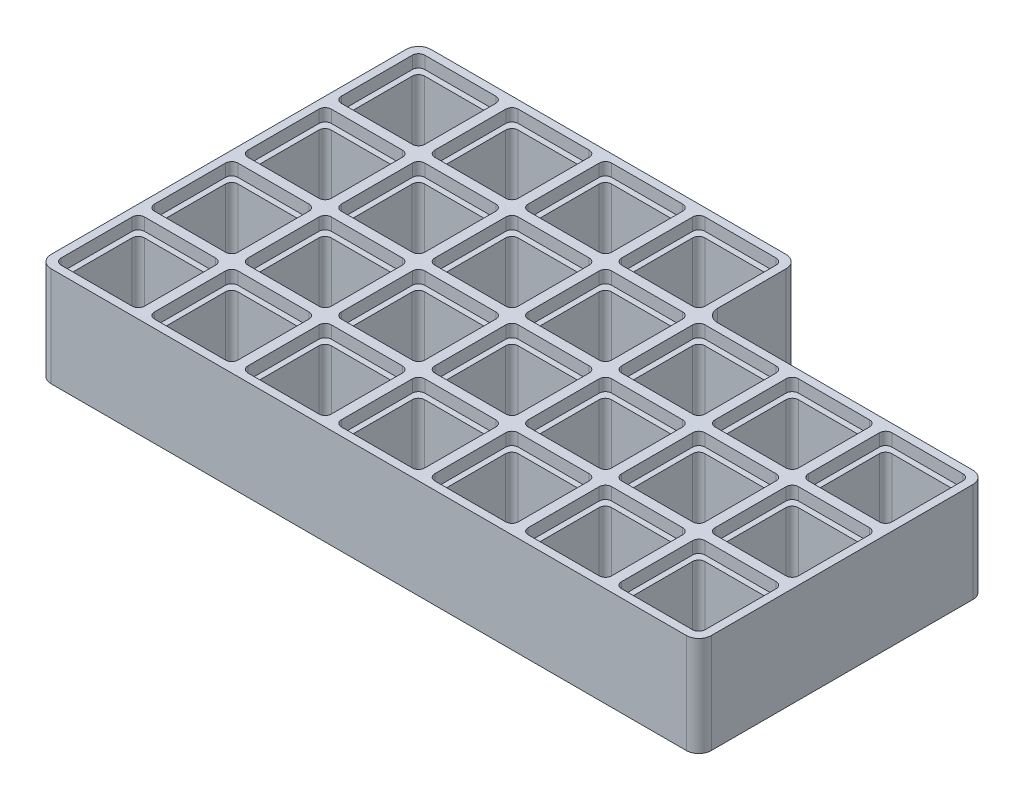
from build123d import *

# Parameters (mm, degrees)
EXTRUDE_1_DEPTH     = 16
CUT_EXTRUDE_2_DEPTH = 18
CUT_EXTRUDE_3_DEPTH = 2
SKETCH_4_R          = 1.5
EXTRUDE_2_DEPTH     = 1.6


with BuildPart() as part:
    # 草图1 → 凸台-拉伸1 (new body)
    with BuildSketch(Plane(origin=(0, 0, 0), x_dir=(1, 0, 0), z_dir=(0, 1, 0))):
        with BuildLine():
            Line((-45, 59), (-45, 48))
            ThreePointArc((-45, 48), (-44.414213562, 46.585786438), (-43, 46))
            Line((-43, 46), (-2, 46))
            ThreePointArc((-2, 46), (-0.585786438, 45.414213562), (0, 44))
            Line((0, 44), (0, 2))
            ThreePointArc((0, 2), (-0.585786438, 0.585786438), (-2, 0))
            Line((-2, 0), (-104, 0))
            ThreePointArc((-104, 0), (-105.414213562, 0.585786438), (-106, 2))
            Line((-106, 2), (-106, 59))
            ThreePointArc((-106, 59), (-105.414213562, 60.414213562), (-104, 61))
            Line((-104, 61), (-47, 61))
            ThreePointArc((-47, 61), (-45.585786438, 60.414213562), (-45, 59))
        make_face()
    extrude(amount=EXTRUDE_1_DEPTH)

    # 草图3 → 切除-拉伸2 (cut)
    with BuildSketch(Plane.XZ):
        with BuildLine():
            Line((-102.8, -2.22), (-93.2, -2.22))
            ThreePointArc((-93.2, -2.22), (-92.492893219, -2.512893219), (-92.2, -3.22))
            Line((-92.2, -3.22), (-92.2, -12.78))
            ThreePointArc((-92.2, -12.78), (-92.492893219, -13.487106781), (-93.2, -13.78))
            Line((-93.2, -13.78), (-102.8, -13.78))
            ThreePointArc((-102.8, -13.78), (-103.507106781, -13.487106781), (-103.8, -12.78))
            Line((-103.8, -12.78), (-103.8, -3.22))
            ThreePointArc((-103.8, -3.22), (-103.507106781, -2.512893219), (-102.8, -2.22))
        make_face()
        with BuildLine():
            Line((-103.8, -18.22), (-103.8, -27.78))
            ThreePointArc((-103.8, -27.78), (-103.507106781, -28.487106781), (-102.8, -28.78))
            Line((-102.8, -28.78), (-93.2, -28.78))
            ThreePointArc((-93.2, -28.78), (-92.492893219, -28.487106781), (-92.2, -27.78))
            Line((-92.2, -27.78), (-92.2, -18.22))
            ThreePointArc((-92.2, -18.22), (-92.492893219, -17.512893219), (-93.2, -17.22))
            Line((-93.2, -17.22), (-102.8, -17.22))
            ThreePointArc((-102.8, -17.22), (-103.507106781, -17.512893219), (-103.8, -18.22))
        make_face()
        with BuildLine():
            Line((-103.8, -33.22), (-103.8, -42.78))
            ThreePointArc((-103.8, -42.78), (-103.507106781, -43.487106781), (-102.8, -43.78))
            Line((-102.8, -43.78), (-93.2, -43.78))
            ThreePointArc((-93.2, -43.78), (-92.492893219, -43.487106781), (-92.2, -42.78))
            Line((-92.2, -42.78), (-92.2, -33.22))
            ThreePointArc((-92.2, -33.22), (-92.492893219, -32.512893219), (-93.2, -32.22))
            Line((-93.2, -32.22), (-102.8, -32.22))
            ThreePointArc((-102.8, -32.22), (-103.507106781, -32.512893219), (-103.8, -33.22))
        make_face()
        with BuildLine():
            Line((-103.8, -48.22), (-103.8, -57.78))
            ThreePointArc((-103.8, -57.78), (-103.507106781, -58.487106781), (-102.8, -58.78))
            Line((-102.8, -58.78), (-93.2, -58.78))
            ThreePointArc((-93.2, -58.78), (-92.492893219, -58.487106781), (-92.2, -57.78))
            Line((-92.2, -57.78), (-92.2, -48.22))
            ThreePointArc((-92.2, -48.22), (-92.492893219, -47.512893219), (-93.2, -47.22))
            Line((-93.2, -47.22), (-102.8, -47.22))
            ThreePointArc((-102.8, -47.22), (-103.507106781, -47.512893219), (-103.8, -48.22))
        make_face()
        with BuildLine():
            Line((-87.8, -2.22), (-78.2, -2.22))
            ThreePointArc((-78.2, -2.22), (-77.492893219, -2.512893219), (-77.2, -3.22))
            Line((-77.2, -3.22), (-77.2, -12.78))
            ThreePointArc((-77.2, -12.78), (-77.492893219, -13.487106781), (-78.2, -13.78))
            Line((-78.2, -13.78), (-87.8, -13.78))
            ThreePointArc((-87.8, -13.78), (-88.507106781, -13.487106781), (-88.8, -12.78))
            Line((-88.8, -12.78), (-88.8, -3.22))
            ThreePointArc((-88.8, -3.22), (-88.507106781, -2.512893219), (-87.8, -2.22))
        make_face()
        with BuildLine():
            Line((-87.8, -17.22), (-78.2, -17.22))
            ThreePointArc((-78.2, -17.22), (-77.492893219, -17.512893219), (-77.2, -18.22))
            Line((-77.2, -18.22), (-77.2, -27.78))
            ThreePointArc((-77.2, -27.78), (-77.492893219, -28.487106781), (-78.2, -28.78))
            Line((-78.2, -28.78), (-87.8, -28.78))
            ThreePointArc((-87.8, -28.78), (-88.507106781, -28.487106781), (-88.8, -27.78))
            Line((-88.8, -27.78), (-88.8, -18.22))
            ThreePointArc((-88.8, -18.22), (-88.507106781, -17.512893219), (-87.8, -17.22))
        make_face()
        with BuildLine():
            Line((-88.8, -33.22), (-88.8, -42.78))
            ThreePointArc((-88.8, -42.78), (-88.507106781, -43.487106781), (-87.8, -43.78))
            Line((-87.8, -43.78), (-78.2, -43.78))
            ThreePointArc((-78.2, -43.78), (-77.492893219, -43.487106781), (-77.2, -42.78))
            Line((-77.2, -42.78), (-77.2, -33.22))
            ThreePointArc((-77.2, -33.22), (-77.492893219, -32.512893219), (-78.2, -32.22))
            Line((-78.2, -32.22), (-87.8, -32.22))
            ThreePointArc((-87.8, -32.22), (-88.507106781, -32.512893219), (-88.8, -33.22))
        make_face()
        with BuildLine():
            Line((-72.8, -2.22), (-63.2, -2.22))
            ThreePointArc((-63.2, -2.22), (-62.492893219, -2.512893219), (-62.2, -3.22))
            Line((-62.2, -3.22), (-62.2, -12.78))
            ThreePointArc((-62.2, -12.78), (-62.492893219, -13.487106781), (-63.2, -13.78))
            Line((-63.2, -13.78), (-72.8, -13.78))
            ThreePointArc((-72.8, -13.78), (-73.507106781, -13.487106781), (-73.8, -12.78))
            Line((-73.8, -12.78), (-73.8, -3.22))
            ThreePointArc((-73.8, -3.22), (-73.507106781, -2.512893219), (-72.8, -2.22))
        make_face()
        with BuildLine():
            Line((-72.8, -17.22), (-63.2, -17.22))
            ThreePointArc((-63.2, -17.22), (-62.492893219, -17.512893219), (-62.2, -18.22))
            Line((-62.2, -18.22), (-62.2, -27.78))
            ThreePointArc((-62.2, -27.78), (-62.492893219, -28.487106781), (-63.2, -28.78))
            Line((-63.2, -28.78), (-72.8, -28.78))
            ThreePointArc((-72.8, -28.78), (-73.507106781, -28.487106781), (-73.8, -27.78))
            Line((-73.8, -27.78), (-73.8, -18.22))
            ThreePointArc((-73.8, -18.22), (-73.507106781, -17.512893219), (-72.8, -17.22))
        make_face()
        with BuildLine():
            Line((-73.8, -33.22), (-73.8, -42.78))
            ThreePointArc((-73.8, -42.78), (-73.507106781, -43.487106781), (-72.8, -43.78))
            Line((-72.8, -43.78), (-63.2, -43.78))
            ThreePointArc((-63.2, -43.78), (-62.492893219, -43.487106781), (-62.2, -42.78))
            Line((-62.2, -42.78), (-62.2, -33.22))
            ThreePointArc((-62.2, -33.22), (-62.492893219, -32.512893219), (-63.2, -32.22))
            Line((-63.2, -32.22), (-72.8, -32.22))
            ThreePointArc((-72.8, -32.22), (-73.507106781, -32.512893219), (-73.8, -33.22))
        make_face()
        with BuildLine():
            Line((-57.8, -2.22), (-48.2, -2.22))
            ThreePointArc((-48.2, -2.22), (-47.492893219, -2.512893219), (-47.2, -3.22))
            Line((-47.2, -3.22), (-47.2, -12.78))
            ThreePointArc((-47.2, -12.78), (-47.492893219, -13.487106781), (-48.2, -13.78))
            Line((-48.2, -13.78), (-57.8, -13.78))
            ThreePointArc((-57.8, -13.78), (-58.507106781, -13.487106781), (-58.8, -12.78))
            Line((-58.8, -12.78), (-58.8, -3.22))
            ThreePointArc((-58.8, -3.22), (-58.507106781, -2.512893219), (-57.8, -2.22))
        make_face()
        with BuildLine():
            Line((-57.8, -17.22), (-48.2, -17.22))
            ThreePointArc((-48.2, -17.22), (-47.492893219, -17.512893219), (-47.2, -18.22))
            Line((-47.2, -18.22), (-47.2, -27.78))
            ThreePointArc((-47.2, -27.78), (-47.492893219, -28.487106781), (-48.2, -28.78))
            Line((-48.2, -28.78), (-57.8, -28.78))
            ThreePointArc((-57.8, -28.78), (-58.507106781, -28.487106781), (-58.8, -27.78))
            Line((-58.8, -27.78), (-58.8, -18.22))
            ThreePointArc((-58.8, -18.22), (-58.507106781, -17.512893219), (-57.8, -17.22))
        make_face()
        with BuildLine():
            Line((-58.8, -33.22), (-58.8, -42.78))
            ThreePointArc((-58.8, -42.78), (-58.507106781, -43.487106781), (-57.8, -43.78))
            Line((-57.8, -43.78), (-48.2, -43.78))
            ThreePointArc((-48.2, -43.78), (-47.492893219, -43.487106781), (-47.2, -42.78))
            Line((-47.2, -42.78), (-47.2, -33.22))
            ThreePointArc((-47.2, -33.22), (-47.492893219, -32.512893219), (-48.2, -32.22))
            Line((-48.2, -32.22), (-57.8, -32.22))
            ThreePointArc((-57.8, -32.22), (-58.507106781, -32.512893219), (-58.8, -33.22))
        make_face()
        with BuildLine():
            Line((-42.8, -2.22), (-33.2, -2.22))
            ThreePointArc((-33.2, -2.22), (-32.492893219, -2.512893219), (-32.2, -3.22))
            Line((-32.2, -3.22), (-32.2, -12.78))
            ThreePointArc((-32.2, -12.78), (-32.492893219, -13.487106781), (-33.2, -13.78))
            Line((-33.2, -13.78), (-42.8, -13.78))
            ThreePointArc((-42.8, -13.78), (-43.507106781, -13.487106781), (-43.8, -12.78))
            Line((-43.8, -12.78), (-43.8, -3.22))
            ThreePointArc((-43.8, -3.22), (-43.507106781, -2.512893219), (-42.8, -2.22))
        make_face()
        with BuildLine():
            Line((-42.8, -17.22), (-33.2, -17.22))
            ThreePointArc((-33.2, -17.22), (-32.492893219, -17.512893219), (-32.2, -18.22))
            Line((-32.2, -18.22), (-32.2, -27.78))
            ThreePointArc((-32.2, -27.78), (-32.492893219, -28.487106781), (-33.2, -28.78))
            Line((-33.2, -28.78), (-42.8, -28.78))
            ThreePointArc((-42.8, -28.78), (-43.507106781, -28.487106781), (-43.8, -27.78))
            Line((-43.8, -27.78), (-43.8, -18.22))
            ThreePointArc((-43.8, -18.22), (-43.507106781, -17.512893219), (-42.8, -17.22))
        make_face()
        with BuildLine():
            Line((-43.8, -33.22), (-43.8, -42.78))
            ThreePointArc((-43.8, -42.78), (-43.507106781, -43.487106781), (-42.8, -43.78))
            Line((-42.8, -43.78), (-33.2, -43.78))
            ThreePointArc((-33.2, -43.78), (-32.492893219, -43.487106781), (-32.2, -42.78))
            Line((-32.2, -42.78), (-32.2, -33.22))
            ThreePointArc((-32.2, -33.22), (-32.492893219, -32.512893219), (-33.2, -32.22))
            Line((-33.2, -32.22), (-42.8, -32.22))
            ThreePointArc((-42.8, -32.22), (-43.507106781, -32.512893219), (-43.8, -33.22))
        make_face()
        with BuildLine():
            Line((-27.8, -2.22), (-18.2, -2.22))
            ThreePointArc((-18.2, -2.22), (-17.492893219, -2.512893219), (-17.2, -3.22))
            Line((-17.2, -3.22), (-17.2, -12.78))
            ThreePointArc((-17.2, -12.78), (-17.492893219, -13.487106781), (-18.2, -13.78))
            Line((-18.2, -13.78), (-27.8, -13.78))
            ThreePointArc((-27.8, -13.78), (-28.507106781, -13.487106781), (-28.8, -12.78))
            Line((-28.8, -12.78), (-28.8, -3.22))
            ThreePointArc((-28.8, -3.22), (-28.507106781, -2.512893219), (-27.8, -2.22))
        make_face()
        with BuildLine():
            Line((-27.8, -17.22), (-18.2, -17.22))
            ThreePointArc((-18.2, -17.22), (-17.492893219, -17.512893219), (-17.2, -18.22))
            Line((-17.2, -18.22), (-17.2, -27.78))
            ThreePointArc((-17.2, -27.78), (-17.492893219, -28.487106781), (-18.2, -28.78))
            Line((-18.2, -28.78), (-27.8, -28.78))
            ThreePointArc((-27.8, -28.78), (-28.507106781, -28.487106781), (-28.8, -27.78))
            Line((-28.8, -27.78), (-28.8, -18.22))
            ThreePointArc((-28.8, -18.22), (-28.507106781, -17.512893219), (-27.8, -17.22))
        make_face()
        with BuildLine():
            Line((-28.8, -33.22), (-28.8, -42.78))
            ThreePointArc((-28.8, -42.78), (-28.507106781, -43.487106781), (-27.8, -43.78))
            Line((-27.8, -43.78), (-18.2, -43.78))
            ThreePointArc((-18.2, -43.78), (-17.492893219, -43.487106781), (-17.2, -42.78))
            Line((-17.2, -42.78), (-17.2, -33.22))
            ThreePointArc((-17.2, -33.22), (-17.492893219, -32.512893219), (-18.2, -32.22))
            Line((-18.2, -32.22), (-27.8, -32.22))
            ThreePointArc((-27.8, -32.22), (-28.507106781, -32.512893219), (-28.8, -33.22))
        make_face()
        with BuildLine():
            Line((-12.8, -2.22), (-3.2, -2.22))
            ThreePointArc((-3.2, -2.22), (-2.492893219, -2.512893219), (-2.2, -3.22))
            Line((-2.2, -3.22), (-2.2, -12.78))
            ThreePointArc((-2.2, -12.78), (-2.492893219, -13.487106781), (-3.2, -13.78))
            Line((-3.2, -13.78), (-12.8, -13.78))
            ThreePointArc((-12.8, -13.78), (-13.507106781, -13.487106781), (-13.8, -12.78))
            Line((-13.8, -12.78), (-13.8, -3.22))
            ThreePointArc((-13.8, -3.22), (-13.507106781, -2.512893219), (-12.8, -2.22))
        make_face()
        with BuildLine():
            Line((-12.8, -17.22), (-3.2, -17.22))
            ThreePointArc((-3.2, -17.22), (-2.492893219, -17.512893219), (-2.2, -18.22))
            Line((-2.2, -18.22), (-2.2, -27.78))
            ThreePointArc((-2.2, -27.78), (-2.492893219, -28.487106781), (-3.2, -28.78))
            Line((-3.2, -28.78), (-12.8, -28.78))
            ThreePointArc((-12.8, -28.78), (-13.507106781, -28.487106781), (-13.8, -27.78))
            Line((-13.8, -27.78), (-13.8, -18.22))
            ThreePointArc((-13.8, -18.22), (-13.507106781, -17.512893219), (-12.8, -17.22))
        make_face()
        with BuildLine():
            Line((-13.8, -33.22), (-13.8, -42.78))
            ThreePointArc((-13.8, -42.78), (-13.507106781, -43.487106781), (-12.8, -43.78))
            Line((-12.8, -43.78), (-3.2, -43.78))
            ThreePointArc((-3.2, -43.78), (-2.492893219, -43.487106781), (-2.2, -42.78))
            Line((-2.2, -42.78), (-2.2, -33.22))
            ThreePointArc((-2.2, -33.22), (-2.492893219, -32.512893219), (-3.2, -32.22))
            Line((-3.2, -32.22), (-12.8, -32.22))
            ThreePointArc((-12.8, -32.22), (-13.507106781, -32.512893219), (-13.8, -33.22))
        make_face()
        with BuildLine():
            Line((-87.8, -47.22), (-78.2, -47.22))
            ThreePointArc((-78.2, -47.22), (-77.492893219, -47.512893219), (-77.2, -48.22))
            Line((-77.2, -48.22), (-77.2, -57.78))
            ThreePointArc((-77.2, -57.78), (-77.492893219, -58.487106781), (-78.2, -58.78))
            Line((-78.2, -58.78), (-87.8, -58.78))
            ThreePointArc((-87.8, -58.78), (-88.507106781, -58.487106781), (-88.8, -57.78))
            Line((-88.8, -57.78), (-88.8, -48.22))
            ThreePointArc((-88.8, -48.22), (-88.507106781, -47.512893219), (-87.8, -47.22))
        make_face()
        with BuildLine():
            Line((-72.8, -47.22), (-63.2, -47.22))
            ThreePointArc((-63.2, -47.22), (-62.492893219, -47.512893219), (-62.2, -48.22))
            Line((-62.2, -48.22), (-62.2, -57.78))
            ThreePointArc((-62.2, -57.78), (-62.492893219, -58.487106781), (-63.2, -58.78))
            Line((-63.2, -58.78), (-72.8, -58.78))
            ThreePointArc((-72.8, -58.78), (-73.507106781, -58.487106781), (-73.8, -57.78))
            Line((-73.8, -57.78), (-73.8, -48.22))
            ThreePointArc((-73.8, -48.22), (-73.507106781, -47.512893219), (-72.8, -47.22))
        make_face()
        with BuildLine():
            Line((-57.8, -47.22), (-48.2, -47.22))
            ThreePointArc((-48.2, -47.22), (-47.492893219, -47.512893219), (-47.2, -48.22))
            Line((-47.2, -48.22), (-47.2, -57.78))
            ThreePointArc((-47.2, -57.78), (-47.492893219, -58.487106781), (-48.2, -58.78))
            Line((-48.2, -58.78), (-57.8, -58.78))
            ThreePointArc((-57.8, -58.78), (-58.507106781, -58.487106781), (-58.8, -57.78))
            Line((-58.8, -57.78), (-58.8, -48.22))
            ThreePointArc((-58.8, -48.22), (-58.507106781, -47.512893219), (-57.8, -47.22))
        make_face()
    extrude(amount=-CUT_EXTRUDE_2_DEPTH, mode=Mode.SUBTRACT)

    # 草图2 → 切除-拉伸3 (cut)
    with BuildSketch(Plane(origin=(0, 16, 0), x_dir=(1, 0, 0), z_dir=(0, 1, 0))):
        with BuildLine():
            Line((-103.7, 29.7), (-92.3, 29.7))
            ThreePointArc((-92.3, 29.7), (-91.592893219, 29.407106781), (-91.3, 28.7))
            Line((-91.3, 28.7), (-91.3, 17.3))
            ThreePointArc((-91.3, 17.3), (-91.592893219, 16.592893219), (-92.3, 16.3))
            Line((-92.3, 16.3), (-103.7, 16.3))
            ThreePointArc((-103.7, 16.3), (-104.407106781, 16.592893219), (-104.7, 17.3))
            Line((-104.7, 17.3), (-104.7, 28.7))
            ThreePointArc((-104.7, 28.7), (-104.407106781, 29.407106781), (-103.7, 29.7))
        make_face()
        with BuildLine():
            Line((-103.7, 14.7), (-92.3, 14.7))
            ThreePointArc((-92.3, 14.7), (-91.592893219, 14.407106781), (-91.3, 13.7))
            Line((-91.3, 13.7), (-91.3, 2.3))
            ThreePointArc((-91.3, 2.3), (-91.592893219, 1.592893219), (-92.3, 1.3))
            Line((-92.3, 1.3), (-103.7, 1.3))
            ThreePointArc((-103.7, 1.3), (-104.407106781, 1.592893219), (-104.7, 2.3))
            Line((-104.7, 2.3), (-104.7, 13.7))
            ThreePointArc((-104.7, 13.7), (-104.407106781, 14.407106781), (-103.7, 14.7))
        make_face()
        with BuildLine():
            Line((-103.7, 44.7), (-92.3, 44.7))
            ThreePointArc((-92.3, 44.7), (-91.592893219, 44.407106781), (-91.3, 43.7))
            Line((-91.3, 43.7), (-91.3, 32.3))
            ThreePointArc((-91.3, 32.3), (-91.592893219, 31.592893219), (-92.3, 31.3))
            Line((-92.3, 31.3), (-103.7, 31.3))
            ThreePointArc((-103.7, 31.3), (-104.407106781, 31.592893219), (-104.7, 32.3))
            Line((-104.7, 32.3), (-104.7, 43.7))
            ThreePointArc((-104.7, 43.7), (-104.407106781, 44.407106781), (-103.7, 44.7))
        make_face()
        with BuildLine():
            Line((-103.7, 59.7), (-92.3, 59.7))
            ThreePointArc((-92.3, 59.7), (-91.592893219, 59.407106781), (-91.3, 58.7))
            Line((-91.3, 58.7), (-91.3, 47.3))
            ThreePointArc((-91.3, 47.3), (-91.592893219, 46.592893219), (-92.3, 46.3))
            Line((-92.3, 46.3), (-103.7, 46.3))
            ThreePointArc((-103.7, 46.3), (-104.407106781, 46.592893219), (-104.7, 47.3))
            Line((-104.7, 47.3), (-104.7, 58.7))
            ThreePointArc((-104.7, 58.7), (-104.407106781, 59.407106781), (-103.7, 59.7))
        make_face()
        with BuildLine():
            Line((-76.3, 13.7), (-76.3, 2.3))
            ThreePointArc((-76.3, 2.3), (-76.592893219, 1.592893219), (-77.3, 1.3))
            Line((-77.3, 1.3), (-88.7, 1.3))
            ThreePointArc((-88.7, 1.3), (-89.407106781, 1.592893219), (-89.7, 2.3))
            Line((-89.7, 2.3), (-89.7, 13.7))
            ThreePointArc((-89.7, 13.7), (-89.407106781, 14.407106781), (-88.7, 14.7))
            Line((-88.7, 14.7), (-77.3, 14.7))
            ThreePointArc((-77.3, 14.7), (-76.592893219, 14.407106781), (-76.3, 13.7))
        make_face()
        with BuildLine():
            Line((-76.3, 28.7), (-76.3, 17.3))
            ThreePointArc((-76.3, 17.3), (-76.592893219, 16.592893219), (-77.3, 16.3))
            Line((-77.3, 16.3), (-88.7, 16.3))
            ThreePointArc((-88.7, 16.3), (-89.407106781, 16.592893219), (-89.7, 17.3))
            Line((-89.7, 17.3), (-89.7, 28.7))
            ThreePointArc((-89.7, 28.7), (-89.407106781, 29.407106781), (-88.7, 29.7))
            Line((-88.7, 29.7), (-77.3, 29.7))
            ThreePointArc((-77.3, 29.7), (-76.592893219, 29.407106781), (-76.3, 28.7))
        make_face()
        with BuildLine():
            Line((-76.3, 43.7), (-76.3, 32.3))
            ThreePointArc((-76.3, 32.3), (-76.592893219, 31.592893219), (-77.3, 31.3))
            Line((-77.3, 31.3), (-88.7, 31.3))
            ThreePointArc((-88.7, 31.3), (-89.407106781, 31.592893219), (-89.7, 32.3))
            Line((-89.7, 32.3), (-89.7, 43.7))
            ThreePointArc((-89.7, 43.7), (-89.407106781, 44.407106781), (-88.7, 44.7))
            Line((-88.7, 44.7), (-77.3, 44.7))
            ThreePointArc((-77.3, 44.7), (-76.592893219, 44.407106781), (-76.3, 43.7))
        make_face()
        with BuildLine():
            Line((-61.3, 13.7), (-61.3, 2.3))
            ThreePointArc((-61.3, 2.3), (-61.592893219, 1.592893219), (-62.3, 1.3))
            Line((-62.3, 1.3), (-73.7, 1.3))
            ThreePointArc((-73.7, 1.3), (-74.407106781, 1.592893219), (-74.7, 2.3))
            Line((-74.7, 2.3), (-74.7, 13.7))
            ThreePointArc((-74.7, 13.7), (-74.407106781, 14.407106781), (-73.7, 14.7))
            Line((-73.7, 14.7), (-62.3, 14.7))
            ThreePointArc((-62.3, 14.7), (-61.592893219, 14.407106781), (-61.3, 13.7))
        make_face()
        with BuildLine():
            Line((-61.3, 28.7), (-61.3, 17.3))
            ThreePointArc((-61.3, 17.3), (-61.592893219, 16.592893219), (-62.3, 16.3))
            Line((-62.3, 16.3), (-73.7, 16.3))
            ThreePointArc((-73.7, 16.3), (-74.407106781, 16.592893219), (-74.7, 17.3))
            Line((-74.7, 17.3), (-74.7, 28.7))
            ThreePointArc((-74.7, 28.7), (-74.407106781, 29.407106781), (-73.7, 29.7))
            Line((-73.7, 29.7), (-62.3, 29.7))
            ThreePointArc((-62.3, 29.7), (-61.592893219, 29.407106781), (-61.3, 28.7))
        make_face()
        with BuildLine():
            Line((-61.3, 43.7), (-61.3, 32.3))
            ThreePointArc((-61.3, 32.3), (-61.592893219, 31.592893219), (-62.3, 31.3))
            Line((-62.3, 31.3), (-73.7, 31.3))
            ThreePointArc((-73.7, 31.3), (-74.407106781, 31.592893219), (-74.7, 32.3))
            Line((-74.7, 32.3), (-74.7, 43.7))
            ThreePointArc((-74.7, 43.7), (-74.407106781, 44.407106781), (-73.7, 44.7))
            Line((-73.7, 44.7), (-62.3, 44.7))
            ThreePointArc((-62.3, 44.7), (-61.592893219, 44.407106781), (-61.3, 43.7))
        make_face()
        with BuildLine():
            Line((-46.3, 13.7), (-46.3, 2.3))
            ThreePointArc((-46.3, 2.3), (-46.592893219, 1.592893219), (-47.3, 1.3))
            Line((-47.3, 1.3), (-58.7, 1.3))
            ThreePointArc((-58.7, 1.3), (-59.407106781, 1.592893219), (-59.7, 2.3))
            Line((-59.7, 2.3), (-59.7, 13.7))
            ThreePointArc((-59.7, 13.7), (-59.407106781, 14.407106781), (-58.7, 14.7))
            Line((-58.7, 14.7), (-47.3, 14.7))
            ThreePointArc((-47.3, 14.7), (-46.592893219, 14.407106781), (-46.3, 13.7))
        make_face()
        with BuildLine():
            Line((-46.3, 28.7), (-46.3, 17.3))
            ThreePointArc((-46.3, 17.3), (-46.592893219, 16.592893219), (-47.3, 16.3))
            Line((-47.3, 16.3), (-58.7, 16.3))
            ThreePointArc((-58.7, 16.3), (-59.407106781, 16.592893219), (-59.7, 17.3))
            Line((-59.7, 17.3), (-59.7, 28.7))
            ThreePointArc((-59.7, 28.7), (-59.407106781, 29.407106781), (-58.7, 29.7))
            Line((-58.7, 29.7), (-47.3, 29.7))
            ThreePointArc((-47.3, 29.7), (-46.592893219, 29.407106781), (-46.3, 28.7))
        make_face()
        with BuildLine():
            Line((-46.3, 43.7), (-46.3, 32.3))
            ThreePointArc((-46.3, 32.3), (-46.592893219, 31.592893219), (-47.3, 31.3))
            Line((-47.3, 31.3), (-58.7, 31.3))
            ThreePointArc((-58.7, 31.3), (-59.407106781, 31.592893219), (-59.7, 32.3))
            Line((-59.7, 32.3), (-59.7, 43.7))
            ThreePointArc((-59.7, 43.7), (-59.407106781, 44.407106781), (-58.7, 44.7))
            Line((-58.7, 44.7), (-47.3, 44.7))
            ThreePointArc((-47.3, 44.7), (-46.592893219, 44.407106781), (-46.3, 43.7))
        make_face()
        with BuildLine():
            Line((-31.3, 13.7), (-31.3, 2.3))
            ThreePointArc((-31.3, 2.3), (-31.592893219, 1.592893219), (-32.3, 1.3))
            Line((-32.3, 1.3), (-43.7, 1.3))
            ThreePointArc((-43.7, 1.3), (-44.407106781, 1.592893219), (-44.7, 2.3))
            Line((-44.7, 2.3), (-44.7, 13.7))
            ThreePointArc((-44.7, 13.7), (-44.407106781, 14.407106781), (-43.7, 14.7))
            Line((-43.7, 14.7), (-32.3, 14.7))
            ThreePointArc((-32.3, 14.7), (-31.592893219, 14.407106781), (-31.3, 13.7))
        make_face()
        with BuildLine():
            Line((-31.3, 28.7), (-31.3, 17.3))
            ThreePointArc((-31.3, 17.3), (-31.592893219, 16.592893219), (-32.3, 16.3))
            Line((-32.3, 16.3), (-43.7, 16.3))
            ThreePointArc((-43.7, 16.3), (-44.407106781, 16.592893219), (-44.7, 17.3))
            Line((-44.7, 17.3), (-44.7, 28.7))
            ThreePointArc((-44.7, 28.7), (-44.407106781, 29.407106781), (-43.7, 29.7))
            Line((-43.7, 29.7), (-32.3, 29.7))
            ThreePointArc((-32.3, 29.7), (-31.592893219, 29.407106781), (-31.3, 28.7))
        make_face()
        with BuildLine():
            Line((-31.3, 43.7), (-31.3, 32.3))
            ThreePointArc((-31.3, 32.3), (-31.592893219, 31.592893219), (-32.3, 31.3))
            Line((-32.3, 31.3), (-43.7, 31.3))
            ThreePointArc((-43.7, 31.3), (-44.407106781, 31.592893219), (-44.7, 32.3))
            Line((-44.7, 32.3), (-44.7, 43.7))
            ThreePointArc((-44.7, 43.7), (-44.407106781, 44.407106781), (-43.7, 44.7))
            Line((-43.7, 44.7), (-32.3, 44.7))
            ThreePointArc((-32.3, 44.7), (-31.592893219, 44.407106781), (-31.3, 43.7))
        make_face()
        with BuildLine():
            Line((-16.3, 13.7), (-16.3, 2.3))
            ThreePointArc((-16.3, 2.3), (-16.592893219, 1.592893219), (-17.3, 1.3))
            Line((-17.3, 1.3), (-28.7, 1.3))
            ThreePointArc((-28.7, 1.3), (-29.407106781, 1.592893219), (-29.7, 2.3))
            Line((-29.7, 2.3), (-29.7, 13.7))
            ThreePointArc((-29.7, 13.7), (-29.407106781, 14.407106781), (-28.7, 14.7))
            Line((-28.7, 14.7), (-17.3, 14.7))
            ThreePointArc((-17.3, 14.7), (-16.592893219, 14.407106781), (-16.3, 13.7))
        make_face()
        with BuildLine():
            Line((-16.3, 28.7), (-16.3, 17.3))
            ThreePointArc((-16.3, 17.3), (-16.592893219, 16.592893219), (-17.3, 16.3))
            Line((-17.3, 16.3), (-28.7, 16.3))
            ThreePointArc((-28.7, 16.3), (-29.407106781, 16.592893219), (-29.7, 17.3))
            Line((-29.7, 17.3), (-29.7, 28.7))
            ThreePointArc((-29.7, 28.7), (-29.407106781, 29.407106781), (-28.7, 29.7))
            Line((-28.7, 29.7), (-17.3, 29.7))
            ThreePointArc((-17.3, 29.7), (-16.592893219, 29.407106781), (-16.3, 28.7))
        make_face()
        with BuildLine():
            Line((-16.3, 43.7), (-16.3, 32.3))
            ThreePointArc((-16.3, 32.3), (-16.592893219, 31.592893219), (-17.3, 31.3))
            Line((-17.3, 31.3), (-28.7, 31.3))
            ThreePointArc((-28.7, 31.3), (-29.407106781, 31.592893219), (-29.7, 32.3))
            Line((-29.7, 32.3), (-29.7, 43.7))
            ThreePointArc((-29.7, 43.7), (-29.407106781, 44.407106781), (-28.7, 44.7))
            Line((-28.7, 44.7), (-17.3, 44.7))
            ThreePointArc((-17.3, 44.7), (-16.592893219, 44.407106781), (-16.3, 43.7))
        make_face()
        with BuildLine():
            Line((-1.3, 13.7), (-1.3, 2.3))
            ThreePointArc((-1.3, 2.3), (-1.592893219, 1.592893219), (-2.3, 1.3))
            Line((-2.3, 1.3), (-13.7, 1.3))
            ThreePointArc((-13.7, 1.3), (-14.407106781, 1.592893219), (-14.7, 2.3))
            Line((-14.7, 2.3), (-14.7, 13.7))
            ThreePointArc((-14.7, 13.7), (-14.407106781, 14.407106781), (-13.7, 14.7))
            Line((-13.7, 14.7), (-2.3, 14.7))
            ThreePointArc((-2.3, 14.7), (-1.592893219, 14.407106781), (-1.3, 13.7))
        make_face()
        with BuildLine():
            Line((-1.3, 28.7), (-1.3, 17.3))
            ThreePointArc((-1.3, 17.3), (-1.592893219, 16.592893219), (-2.3, 16.3))
            Line((-2.3, 16.3), (-13.7, 16.3))
            ThreePointArc((-13.7, 16.3), (-14.407106781, 16.592893219), (-14.7, 17.3))
            Line((-14.7, 17.3), (-14.7, 28.7))
            ThreePointArc((-14.7, 28.7), (-14.407106781, 29.407106781), (-13.7, 29.7))
            Line((-13.7, 29.7), (-2.3, 29.7))
            ThreePointArc((-2.3, 29.7), (-1.592893219, 29.407106781), (-1.3, 28.7))
        make_face()
        with BuildLine():
            Line((-1.3, 43.7), (-1.3, 32.3))
            ThreePointArc((-1.3, 32.3), (-1.592893219, 31.592893219), (-2.3, 31.3))
            Line((-2.3, 31.3), (-13.7, 31.3))
            ThreePointArc((-13.7, 31.3), (-14.407106781, 31.592893219), (-14.7, 32.3))
            Line((-14.7, 32.3), (-14.7, 43.7))
            ThreePointArc((-14.7, 43.7), (-14.407106781, 44.407106781), (-13.7, 44.7))
            Line((-13.7, 44.7), (-2.3, 44.7))
            ThreePointArc((-2.3, 44.7), (-1.592893219, 44.407106781), (-1.3, 43.7))
        make_face()
        with BuildLine():
            Line((-76.3, 58.7), (-76.3, 47.3))
            ThreePointArc((-76.3, 47.3), (-76.592893219, 46.592893219), (-77.3, 46.3))
            Line((-77.3, 46.3), (-88.7, 46.3))
            ThreePointArc((-88.7, 46.3), (-89.407106781, 46.592893219), (-89.7, 47.3))
            Line((-89.7, 47.3), (-89.7, 58.7))
            ThreePointArc((-89.7, 58.7), (-89.407106781, 59.407106781), (-88.7, 59.7))
            Line((-88.7, 59.7), (-77.3, 59.7))
            ThreePointArc((-77.3, 59.7), (-76.592893219, 59.407106781), (-76.3, 58.7))
        make_face()
        with BuildLine():
            Line((-61.3, 58.7), (-61.3, 47.3))
            ThreePointArc((-61.3, 47.3), (-61.592893219, 46.592893219), (-62.3, 46.3))
            Line((-62.3, 46.3), (-73.7, 46.3))
            ThreePointArc((-73.7, 46.3), (-74.407106781, 46.592893219), (-74.7, 47.3))
            Line((-74.7, 47.3), (-74.7, 58.7))
            ThreePointArc((-74.7, 58.7), (-74.407106781, 59.407106781), (-73.7, 59.7))
            Line((-73.7, 59.7), (-62.3, 59.7))
            ThreePointArc((-62.3, 59.7), (-61.592893219, 59.407106781), (-61.3, 58.7))
        make_face()
        with BuildLine():
            Line((-46.3, 58.7), (-46.3, 47.3))
            ThreePointArc((-46.3, 47.3), (-46.592893219, 46.592893219), (-47.3, 46.3))
            Line((-47.3, 46.3), (-58.7, 46.3))
            ThreePointArc((-58.7, 46.3), (-59.407106781, 46.592893219), (-59.7, 47.3))
            Line((-59.7, 47.3), (-59.7, 58.7))
            ThreePointArc((-59.7, 58.7), (-59.407106781, 59.407106781), (-58.7, 59.7))
            Line((-58.7, 59.7), (-47.3, 59.7))
            ThreePointArc((-47.3, 59.7), (-46.592893219, 59.407106781), (-46.3, 58.7))
        make_face()
    extrude(amount=-CUT_EXTRUDE_3_DEPTH, mode=Mode.SUBTRACT)

    # 草图4 → 凸台-拉伸2 (add)
    with BuildSketch(Plane.XZ):
        with Locations(Location((-90.5, -15.5, 0), (0, 0, 90))):
            Circle(SKETCH_4_R)
        with Locations(Location((-90.5, -45.5, 0), (0, 0, 90))):
            Circle(SKETCH_4_R)
        with Locations(Location((-15.5, -15.5, 0), (0, 0, 90))):
            Circle(SKETCH_4_R)
        with Locations(Location((-15.5, -30.5, 0), (0, 0, 90))):
            Circle(SKETCH_4_R)
    extrude(amount=EXTRUDE_2_DEPTH)


solid = part.part
